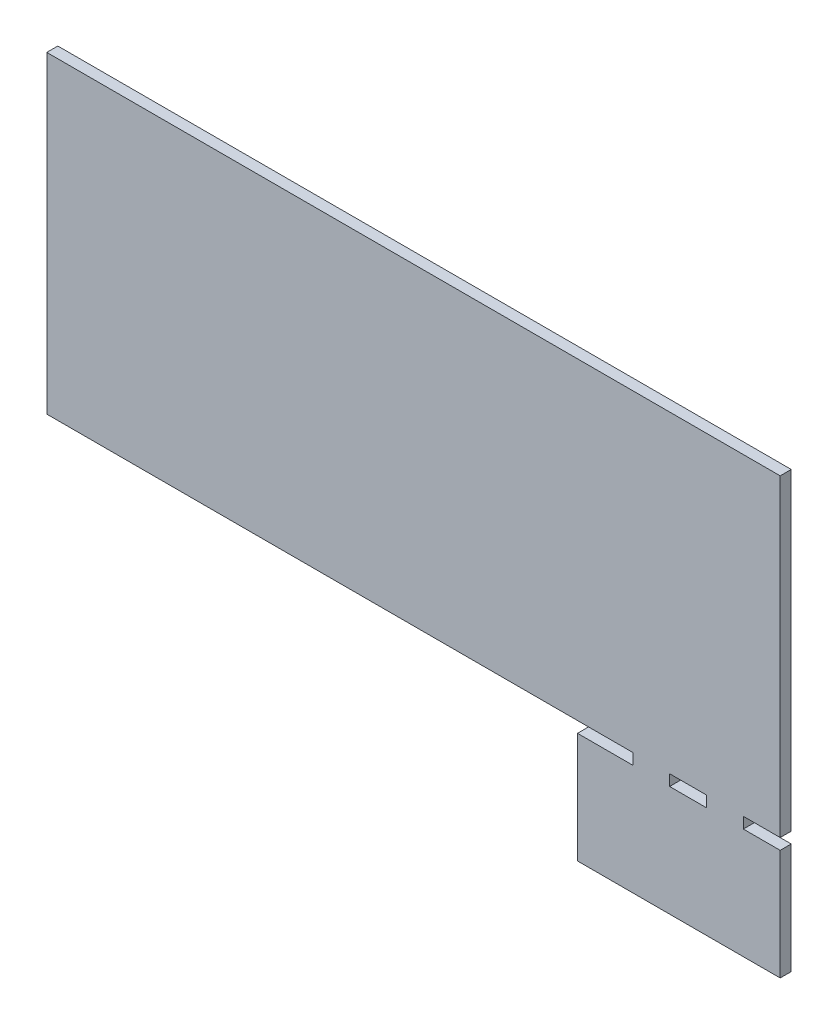
from build123d import *

# Parameters (mm, degrees)
SKETCH1_W           = 55
SKETCH1_H           = 55
BOSS_EXTRUDE1_DEPTH = 3
SKETCH2_W           = 10
SKETCH2_H           = 3
SKETCH2_W_2         = 15
CUT_EXTRUDE1_DEPTH  = 3
SKETCH3_W           = 55
SKETCH3_H           = 30
BOSS_EXTRUDE2_DEPTH = 3
SKETCH4_W           = 144
SKETCH4_H           = 52
BOSS_EXTRUDE3_DEPTH = 3
SKETCH5_W           = 199
SKETCH5_H           = 13
BOSS_EXTRUDE4_DEPTH = 3
SKETCH6_W           = 199
SKETCH6_H           = 20
BOSS_EXTRUDE5_DEPTH = 3
SKETCH7_R           = 2
SKETCH7_W           = 40
SKETCH7_H           = 20
CUT_EXTRUDE22_DEPTH = 33
SKETCH8_W           = 40
SKETCH8_H           = 9
CUT_EXTRUDE23_DEPTH = 33
SKETCH9_W           = 63.816090929
SKETCH9_H           = 30.906314682
BOSS_EXTRUDE6_DEPTH = 3


with BuildPart() as part:
    # Sketch1 → Boss-Extrude1 (new body)
    with BuildSketch(Plane.XY):
        Rectangle(SKETCH1_W, SKETCH1_H)
    extrude(amount=BOSS_EXTRUDE1_DEPTH)

    # Sketch2 → Cut-Extrude1 (cut)
    with BuildSketch(Plane.XY.offset(3)):
        with Locations((22.5, -26)):
            Rectangle(SKETCH2_W, SKETCH2_H)
        with Locations((2.5, -26)):
            Rectangle(SKETCH2_W, SKETCH2_H)
        with Locations((-20, -26)):
            Rectangle(SKETCH2_W_2, SKETCH2_H)
    extrude(amount=-CUT_EXTRUDE1_DEPTH, mode=Mode.SUBTRACT)

    # Sketch3 → Boss-Extrude2 (add)
    with BuildSketch(Plane(origin=(0, 0, 0), x_dir=(-1, 0, 0), z_dir=(0, 0, -1))):
        with Locations((0, -42.5)):
            Rectangle(SKETCH3_W, SKETCH3_H)
    extrude(amount=-BOSS_EXTRUDE2_DEPTH)

    # Sketch4 → Boss-Extrude3 (add)
    with BuildSketch(Plane(origin=(0, 0, 0), x_dir=(-1, 0, 0), z_dir=(0, 0, -1))):
        with Locations((99.5, 1.5)):
            Rectangle(SKETCH4_W, SKETCH4_H)
    extrude(amount=-BOSS_EXTRUDE3_DEPTH)

    # Sketch5 → Boss-Extrude4 (add)
    with BuildSketch(Plane(origin=(0, 0, 0), x_dir=(-1, 0, 0), z_dir=(0, 0, -1))):
        with Locations((72, 34)):
            Rectangle(SKETCH5_W, SKETCH5_H)
    extrude(amount=-BOSS_EXTRUDE4_DEPTH)

    # Sketch6 → Boss-Extrude5 (add)
    with BuildSketch(Plane(origin=(0, 0, 0), x_dir=(-1, 0, 0), z_dir=(0, 0, -1))):
        with Locations((72, 50.5)):
            Rectangle(SKETCH6_W, SKETCH6_H)
    extrude(amount=-BOSS_EXTRUDE5_DEPTH)

    # Sketch7 → Cut-Extrude22 (cut)
    with BuildSketch(Plane(origin=(0, 0, 0), x_dir=(-1, 0, 0), z_dir=(0, 0, -1))):
        with Locations((168.5, 46.5)):
            Circle(SKETCH7_R)
        with Locations((168.5, 36.5)):
            Circle(SKETCH7_R)
        with Locations((118.5, 36.5)):
            Circle(SKETCH7_R)
        with Locations((118.5, 46.5)):
            Circle(SKETCH7_R)
        with Locations((143.5, 41.5)):
            Rectangle(SKETCH7_W, SKETCH7_H)
    extrude(amount=-CUT_EXTRUDE22_DEPTH, mode=Mode.SUBTRACT)

    # Sketch8 → Cut-Extrude23 (cut)
    with BuildSketch(Plane(origin=(0, 0, 0), x_dir=(-1, 0, 0), z_dir=(0, 0, -1))):
        with Locations((143.5, 56)):
            Rectangle(SKETCH8_W, SKETCH8_H)
    extrude(amount=-CUT_EXTRUDE23_DEPTH, mode=Mode.SUBTRACT)

    # Sketch9 → Boss-Extrude6 (add)
    with BuildSketch(Plane(origin=(0, 0, 0), x_dir=(-1, 0, 0), z_dir=(0, 0, -1))):
        with Locations((139.591954536, 45.046842659)):
            Rectangle(SKETCH9_W, SKETCH9_H)
    extrude(amount=-BOSS_EXTRUDE6_DEPTH)


solid = part.part
